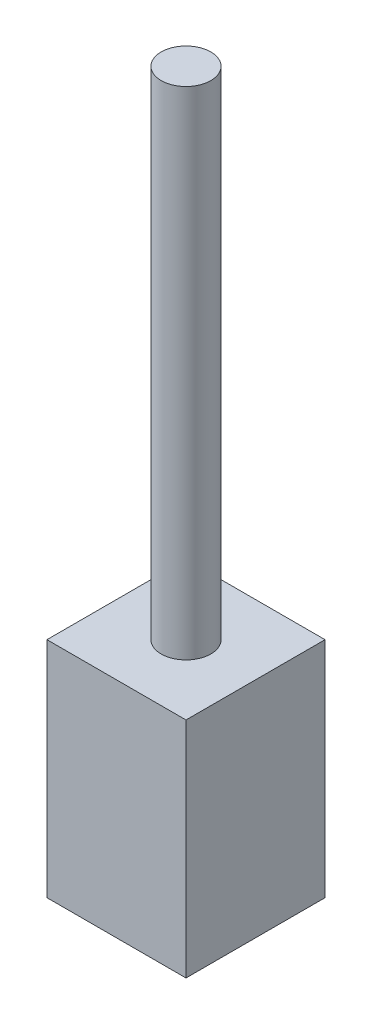
from build123d import *

# Parameters (mm, degrees)
SKETCH1_W      = 28
SKETCH1_H      = 28
EXTRUDE1_DEPTH = 45
SKETCH2_R      = 5
EXTRUDE2_DEPTH = 100


with BuildPart() as part:
    # Sketch1 → Extrude1 (new body)
    with BuildSketch(Plane(origin=(0, 0, 0), x_dir=(1, 0, 0), z_dir=(0, 1, 0))):
        with Locations((14, 14)):
            Rectangle(SKETCH1_W, SKETCH1_H)
    extrude(amount=EXTRUDE1_DEPTH)

    # Sketch2 → Extrude2 (add)
    with BuildSketch(Plane(origin=(0, 45, 0), x_dir=(1, 0, 0), z_dir=(0, 1, 0))):
        with Locations(Location((14, 14, 0), (0, 0, 90))):
            Circle(SKETCH2_R)
    extrude(amount=EXTRUDE2_DEPTH)


solid = part.part
